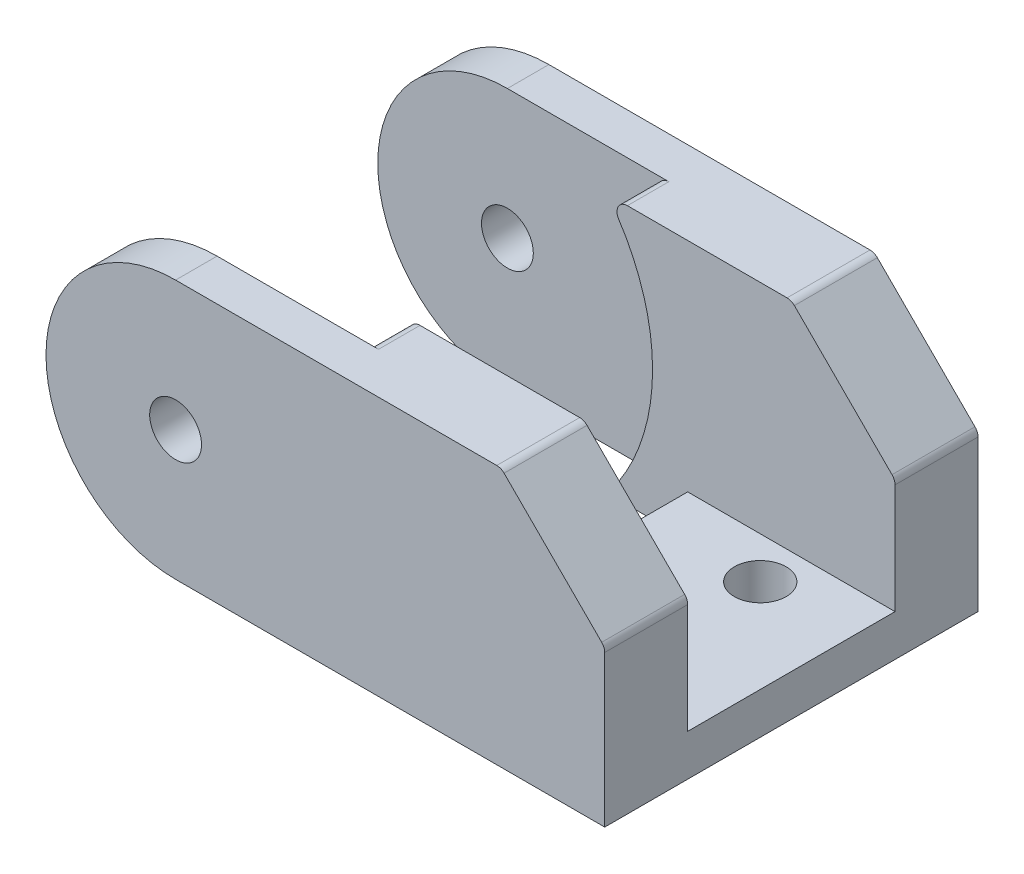
from build123d import *

# Parameters (mm, degrees)
BOSS_EXTRUDE1_DEPTH  = 4
BOSS_EXTRUDE7_DEPTH  = 4
SKETCH9_W            = 20
SKETCH9_H            = 36
BOSS_EXTRUDE8_DEPTH  = 4
BOSS_EXTRUDE9_DEPTH  = 8
BOSS_EXTRUDE10_DEPTH = 4
FILLET4_R            = 1
SKETCH11_R           = 2.5
CUT_EXTRUDE2_DEPTH   = 57.25989309
CHAMFER1_SIZE        = 10
SKETCH12_R           = 2.5
CUT_EXTRUDE3_DEPTH   = 4
FILLET5_R            = 1
SCALE1_SCALE         = 0.5


with BuildPart() as part:
    # Sketch1 → Boss-Extrude1 (new body)
    with BuildSketch(Plane.XY):
        with BuildLine():
            ThreePointArc((0, 12.5), (-12.5, 0), (0, -12.5))
            Line((0, -12.5), (26.387505004, -12.5))
            ThreePointArc((26.387505004, -12.5), (22, 0), (26.387505004, 12.5))
            Line((26.387505004, 12.5), (0, 12.5))
        make_face()
    extrude(amount=BOSS_EXTRUDE1_DEPTH)

    # Sketch8 → Boss-Extrude7 (add)
    with BuildSketch(Plane(origin=(0, 0, 0), x_dir=(-1, 0, 0), z_dir=(0, 0, -1))):
        with BuildLine():
            Line((-26.387505004, 12.5), (-41.387505004, 12.5))
            Line((-41.387505004, 12.5), (-41.387505004, -12.5))
            Line((-41.387505004, -12.5), (-26.387505004, -12.5))
            ThreePointArc((-26.387505004, -12.5), (-22, 0), (-26.387505004, 12.5))
        make_face()
    extrude(amount=-BOSS_EXTRUDE7_DEPTH)


with BuildPart() as body_2:
    # Mirror3: mirrored copy
    add(part.part.mirror(Plane.XY.offset(18)))


with BuildPart() as part_1:
    add(part.part)

    add(body_2.part)  # Boss-Extrude8 merges body 2
    # Sketch9 → Boss-Extrude8 (add)
    with BuildSketch(Plane.XZ.offset(12.5)):
        with Locations((31.387505004, 18)):
            Rectangle(SKETCH9_W, SKETCH9_H)
    extrude(amount=-BOSS_EXTRUDE8_DEPTH)

    # Sketch1<4> → Boss-Extrude9 (add)
    with BuildSketch(Plane.XY):
        with BuildLine():
            ThreePointArc((13.612494996, 12.5), (18, 0), (13.612494996, -12.5))
            Line((13.612494996, -12.5), (40, -12.5))
            ThreePointArc((40, -12.5), (27.5, 0), (40, 12.5))
            Line((40, 12.5), (13.612494996, 12.5))
        make_face()
    boss_extrude9 = extrude(amount=BOSS_EXTRUDE9_DEPTH)

    # Sketch10 → Boss-Extrude10 (add)
    with BuildSketch(Plane.XY.offset(4)):
        with BuildLine():
            Line((41.387505004, 12.5), (40, 12.5))
            ThreePointArc((40, 12.5), (28.543560763, 5), (30.83484861, -8.5))
            Line((30.83484861, -8.5), (41.387505004, -8.5))
            Line((41.387505004, -8.5), (41.387505004, 12.5))
        make_face()
    boss_extrude10 = extrude(amount=BOSS_EXTRUDE10_DEPTH)

    # Mirror4: Boss-Extrude9, Boss-Extrude10 across plane
    add(boss_extrude9.mirror(Plane.XY.offset(18)))
    add(boss_extrude10.mirror(Plane.XY.offset(18)))

    # Fillet4
    fillet4_edges = [part_1.edges().sort_by_distance(p)[0] for p in [
        (13.612494996, -12.5, 30),
        (13.612494996, 12.5, 30),
        (13.612494996, -12.5, 6),
        (13.612494996, 12.5, 6),
    ]]
    fillet(fillet4_edges, radius=FILLET4_R)

    # Sketch11 → Cut-Extrude2 (cut, through all)
    with BuildSketch(Plane.XY.offset(36)):
        Circle(SKETCH11_R)
    extrude(amount=-CUT_EXTRUDE2_DEPTH, mode=Mode.SUBTRACT)

    # Chamfer1
    chamfer1_edges = [part_1.edges().sort_by_distance(p)[0] for p in [
        (41.387505004, 12.5, 32),
        (41.387505004, 12.5, 4),
    ]]
    chamfer(chamfer1_edges, length=CHAMFER1_SIZE)

    # Sketch12 → Cut-Extrude3 (cut)
    with BuildSketch(Plane(origin=(0, -8.5, 0), x_dir=(1, 0, 0), z_dir=(0, 1, 0))):
        with Locations((32.387505004, -12)):
            Circle(SKETCH12_R)
        with Locations((32.387505004, -24)):
            Circle(SKETCH12_R)
    extrude(amount=-CUT_EXTRUDE3_DEPTH, mode=Mode.SUBTRACT)

    # Fillet5
    fillet5_edges = [part_1.edges().sort_by_distance(p)[0] for p in [
        (41.387505004, 2.5, 32),
        (41.387505004, 2.5, 4),
        (31.387505004, 12.5, 4),
        (31.387505004, 12.5, 32),
    ]]
    fillet(fillet5_edges, radius=FILLET5_R)


with BuildPart() as part_2:
    # Scale1: scaled about (0, 0, 0)
    add(part_1.part.scale(SCALE1_SCALE))


solid = part_2.part
